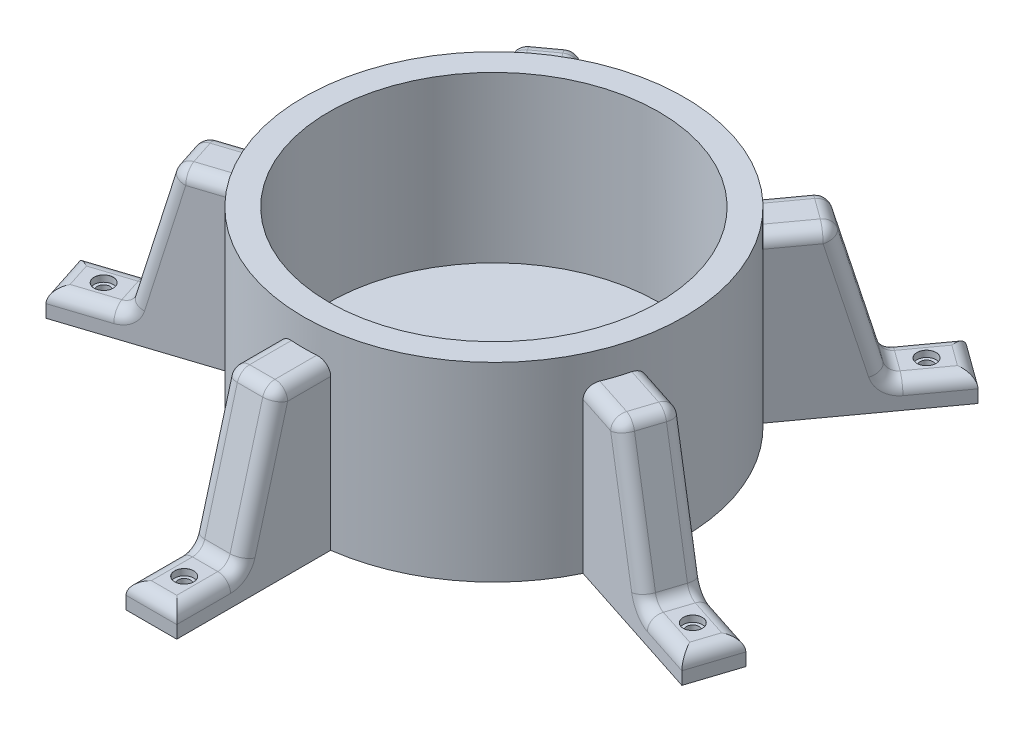
from build123d import *

# Parameters (mm, degrees)
CROQUIS4_R              = 150
SALIENTE_EXTRUIR3_DEPTH = 150
CROQUIS7_R              = 130
CORTAR_EXTRUIR1_DEPTH   = 130
SALIENTE_EXTRUIR5_DEPTH = 20
REDONDEO1_R             = 10
MATRIZC1_COUNT          = 5
REDONDEO1_OF_MATRIZC1_R = 10
CROQUIS13_R             = 20
CORTAR_EXTRUIR2_DEPTH   = 406.648747611


with BuildPart() as part:
    # Croquis4 → Saliente-Extruir3 (new body)
    with BuildSketch(Plane(origin=(0, 0, 0), x_dir=(1, 0, 0), z_dir=(0, 1, 0))):
        with Locations(Location((0, 0, 0), (0, 0, 270))):
            Circle(CROQUIS4_R)
    extrude(amount=SALIENTE_EXTRUIR3_DEPTH)

    # Croquis7 → Cortar-Extruir1 (cut)
    with BuildSketch(Plane(origin=(0, 150, 0), x_dir=(1, 0, 0), z_dir=(0, 1, 0))):
        with Locations(Location((0, 0, 0), (0, 0, 270))):
            Circle(CROQUIS7_R)
    extrude(amount=-CORTAR_EXTRUIR1_DEPTH, mode=Mode.SUBTRACT)

    # Croquis8 → Saliente-Extruir5 (add, symmetric)
    with BuildSketch(Plane(origin=(0, 0, 0), x_dir=(0, 0, -1), z_dir=(1, 0, 0))):
        Polygon((-190.212550173, 128.702405531), (-220, 20), (-270, 20), (-270, 0), (-141.546888578, 0), (-141.546888578, 128.702405531), align=None)
    saliente_extruir5 = extrude(amount=SALIENTE_EXTRUIR5_DEPTH, both=True)

    # Redondeo1
    redondeo1_edges = [part.edges().sort_by_distance(p)[0] for p in [
        (20, 128.702405531, 169.436618823),
        (20, 74.351202766, 205.106275086),
        (20, 20, 245),
        (-20, 128.702405531, 169.436618823),
        (0, 128.702405531, 190.212550173),
        (0, 20, 270),
        (-20, 20, 245),
        (0, 20, 220),
        (-20, 74.351202766, 205.106275086),
    ]]
    fillet(redondeo1_edges, radius=REDONDEO1_R)

    # Croquis12 → Refrentado para tornillo con cabeza plana de M81 (revolve, cut)
    with BuildSketch(Plane(origin=(0, 20, 244.12063984), x_dir=(0, 0, 1), z_dir=(1, 0, 0))):
        Polygon((0, 0), (0, 20), (5, 20), (5, 5), (7.5, 5), (7.5, 0.025), (7.525, 0), align=None)
    refrentado_para_tornillo_con_cabeza_plan = revolve(axis=Axis((0, 26.35, 244.12063984), (0, -1, 0)), mode=Mode.SUBTRACT)

    # MatrizC1: Saliente-Extruir5, Refrentado para tornillo con cabeza plana de M81 ×5 about axis
    matrizc1_axis = Axis((0, 0, 0), (0, 1, 0))
    add([saliente_extruir5.rotate(matrizc1_axis, i * 360 / MATRIZC1_COUNT) for i in range(1, MATRIZC1_COUNT)])
    add([refrentado_para_tornillo_con_cabeza_plan.rotate(matrizc1_axis, i * 360 / MATRIZC1_COUNT) for i in range(1, MATRIZC1_COUNT)], mode=Mode.SUBTRACT)

    # Redondeo1 of MatrizC1
    redondeo1_of_matrizc1_edges = [part.edges().sort_by_distance(p)[0] for p in [
        (167.324140318, 128.702405531, 33.33766436),
        (201.247999341, 74.351202766, 44.360194329),
        (239.18918638, 20, 56.688033296),
        (154.963460543, 128.702405531, 71.379925012),
        (180.902885323, 128.702405531, 58.778910547),
        (256.7852594, 20, 83.434588481),
        (226.828506605, 20, 94.730293948),
        (209.232433585, 20, 67.983738762),
        (188.887319566, 74.351202766, 82.402454981),
        (83.412005855, 128.702405531, -148.832809143),
        (104.378103761, 74.351202766, -177.690167244),
        (127.827046924, 20, -209.964868668),
        (115.77268563, 128.702405531, -125.321399051),
        (111.804131793, 128.702405531, -153.885185633),
        (158.702018119, 20, -218.434588481),
        (160.187726699, 20, -186.453458576),
        (129.312755504, 20, -177.983738762),
        (136.738783536, 74.351202766, -154.178757152),
        (-115.77268563, 128.702405531, -125.321399051),
        (-136.738783536, 74.351202766, -154.178757152),
        (-160.187726699, 20, -186.453458576),
        (-83.412005855, 128.702405531, -148.832809143),
        (-111.804131793, 128.702405531, -153.885185633),
        (-158.702018119, 20, -218.434588481),
        (-127.827046924, 20, -209.964868668),
        (-129.312755504, 20, -177.983738762),
        (-104.378103761, 74.351202766, -177.690167244),
        (-154.963460543, 128.702405531, 71.379925012),
        (-188.887319566, 74.351202766, 82.402454981),
        (-226.828506605, 20, 94.730293948),
        (-167.324140318, 128.702405531, 33.33766436),
        (-180.902885323, 128.702405531, 58.778910547),
        (-256.7852594, 20, 83.434588481),
        (-239.18918638, 20, 56.688033296),
        (-209.232433585, 20, 67.983738762),
        (-201.247999341, 74.351202766, 44.360194329),
    ]]
    fillet(redondeo1_of_matrizc1_edges, radius=REDONDEO1_OF_MATRIZC1_R)

    # Croquis13 → Cortar-Extruir2 (cut, through all)
    with BuildSketch(Plane(origin=(0, 0, 0), x_dir=(1, 0, 0), z_dir=(0, 1, 0))):
        with Locations(Location((0, 0, 0), (0, 0, 270))):
            Circle(CROQUIS13_R)
    extrude(amount=CORTAR_EXTRUIR2_DEPTH, mode=Mode.SUBTRACT)


solid = part.part
